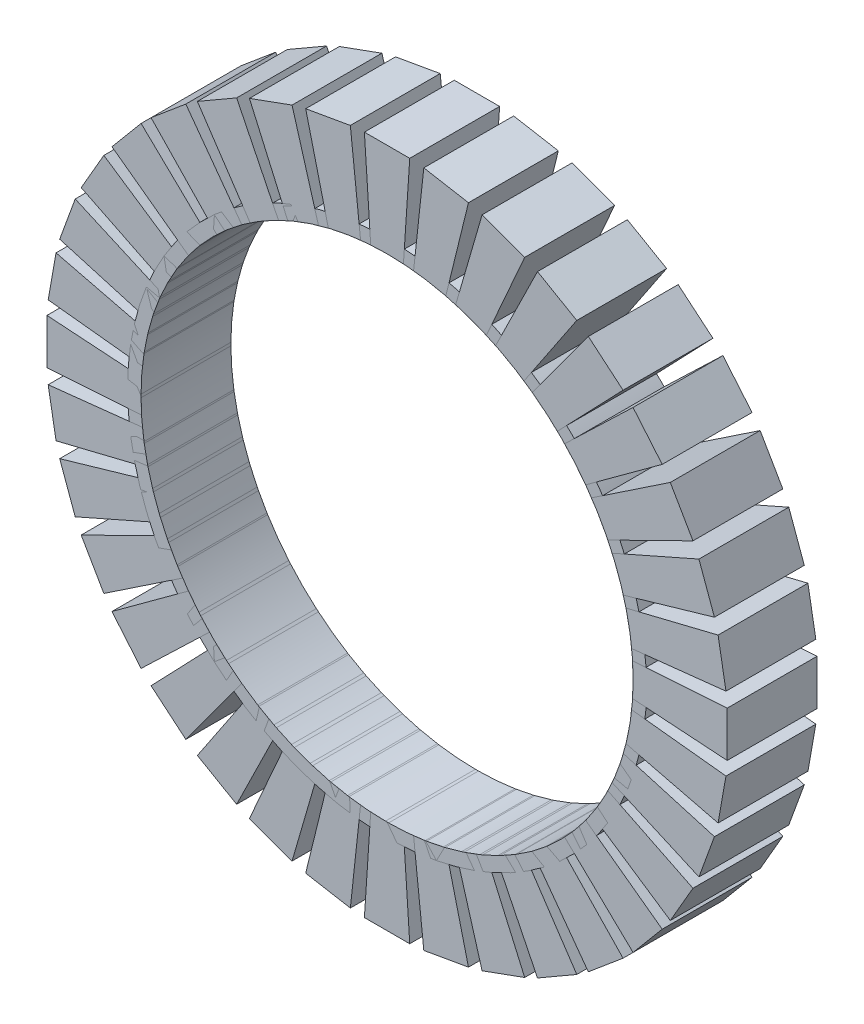
from build123d import *

# Parameters (mm, degrees)
BOSS_EXTRUDE1_DEPTH    = 10.7
BOSS_EXTRUDE1_2_DEPTH  = 10.7
BOSS_EXTRUDE1_3_DEPTH  = 10.7
BOSS_EXTRUDE1_4_DEPTH  = 10.7
BOSS_EXTRUDE1_5_DEPTH  = 10.7
BOSS_EXTRUDE1_6_DEPTH  = 10.7
BOSS_EXTRUDE1_7_DEPTH  = 10.7
BOSS_EXTRUDE1_8_DEPTH  = 10.7
BOSS_EXTRUDE1_9_DEPTH  = 10.7
BOSS_EXTRUDE1_10_DEPTH = 10.7
BOSS_EXTRUDE1_11_DEPTH = 10.7
BOSS_EXTRUDE1_12_DEPTH = 10.7
BOSS_EXTRUDE1_13_DEPTH = 10.7
BOSS_EXTRUDE1_14_DEPTH = 10.7
BOSS_EXTRUDE1_15_DEPTH = 10.7
BOSS_EXTRUDE1_16_DEPTH = 10.7
BOSS_EXTRUDE1_17_DEPTH = 10.7
BOSS_EXTRUDE1_18_DEPTH = 10.7
BOSS_EXTRUDE1_19_DEPTH = 10.7
BOSS_EXTRUDE1_20_DEPTH = 10.7
BOSS_EXTRUDE1_21_DEPTH = 10.7
BOSS_EXTRUDE1_22_DEPTH = 10.7
BOSS_EXTRUDE1_23_DEPTH = 10.7
BOSS_EXTRUDE1_24_DEPTH = 10.7
BOSS_EXTRUDE1_25_DEPTH = 10.7
BOSS_EXTRUDE1_26_DEPTH = 10.7
BOSS_EXTRUDE1_27_DEPTH = 10.7
BOSS_EXTRUDE1_28_DEPTH = 10.7
BOSS_EXTRUDE1_29_DEPTH = 10.7
BOSS_EXTRUDE1_30_DEPTH = 10.7
BOSS_EXTRUDE1_31_DEPTH = 10.7
BOSS_EXTRUDE1_32_DEPTH = 10.7
BOSS_EXTRUDE1_33_DEPTH = 10.7
BOSS_EXTRUDE1_34_DEPTH = 10.7
BOSS_EXTRUDE1_35_DEPTH = 10.7
BOSS_EXTRUDE1_36_DEPTH = 10.7
SKETCH2_R              = 30.9
SKETCH2_R_2            = 29.3
BOSS_EXTRUDE2_DEPTH    = 10.7


with BuildPart() as part:
    # Sketch1 → Boss-Extrude1 (new body)
    with BuildSketch(Plane.XY):
        with BuildLine():
            Line((-2.7, 40.5), (2.7, 40.5))
            Line((2.7, 40.5), (1.949007008, 29.235105125))
            ThreePointArc((1.949007008, 29.235105125), (0, 29.3), (-1.949007008, 29.235105125))
            Line((-1.949007008, 29.235105125), (-2.7, 40.5))
        make_face()
    extrude(amount=BOSS_EXTRUDE1_DEPTH)


with BuildPart() as body_2:
    # Sketch1 → Boss-Extrude1 2 (new body)
    with BuildSketch(Plane.XY):
        with BuildLine():
            Line((3.157225516, 29.129399703), (4.373770262, 40.353564077))
            Line((4.373770262, 40.353564077), (9.691732129, 39.415863917))
            Line((9.691732129, 39.415863917), (6.996019941, 28.452516672))
            ThreePointArc((6.996019941, 28.452516672), (5.087891606, 28.854867163), (3.157225516, 29.129399703))
        make_face()
    extrude(amount=BOSS_EXTRUDE1_2_DEPTH)


with BuildPart() as body_3:
    # Sketch1 → Boss-Extrude1 3 (new body)
    with BuildSketch(Plane.XY):
        with BuildLine():
            Line((8.167527341, 28.13861221), (11.314645729, 38.981005529))
            Line((11.314645729, 38.981005529), (16.388985881, 37.134096755))
            Line((16.388985881, 37.134096755), (11.830462349, 26.805412898))
            ThreePointArc((11.830462349, 26.805412898), (10.021190199, 27.532993789), (8.167527341, 28.13861221))
        make_face()
    extrude(amount=BOSS_EXTRUDE1_3_DEPTH)


with BuildPart() as body_4:
    # Sketch1 → Boss-Extrude1 4 (new body)
    with BuildSketch(Plane.XY):
        with BuildLine():
            Line((12.929662981, 26.292847225), (17.91173141, 36.424028853))
            Line((17.91173141, 36.424028853), (22.58826859, 33.724028853))
            Line((22.58826859, 33.724028853), (16.305442144, 24.343840217))
            ThreePointArc((16.305442144, 24.343840217), (14.65, 25.374544331), (12.929662981, 26.292847225))
        make_face()
    extrude(amount=BOSS_EXTRUDE1_4_DEPTH)


with BuildPart() as body_5:
    # Sketch1 → Boss-Extrude1 5 (new body)
    with BuildSketch(Plane.XY):
        with BuildLine():
            Line((17.298937354, 23.648187381), (23.964578196, 32.760326492))
            Line((23.964578196, 32.760326492), (28.101218189, 29.2892734))
            Line((28.101218189, 29.2892734), (20.284989331, 21.142592269))
            ThreePointArc((20.284989331, 21.142592269), (18.833676964, 22.445102183), (17.298937354, 23.648187381))
        make_face()
    extrude(amount=BOSS_EXTRUDE1_5_DEPTH)


with BuildPart() as body_6:
    # Sketch1 → Boss-Extrude1 6 (new body)
    with BuildSketch(Plane.XY):
        with BuildLine():
            Line((21.142592269, 20.284989331), (29.2892734, 28.101218189))
            Line((29.2892734, 28.101218189), (32.760326492, 23.964578196))
            Line((32.760326492, 23.964578196), (23.648187381, 17.298937354))
            ThreePointArc((23.648187381, 17.298937354), (22.445102183, 18.833676964), (21.142592269, 20.284989331))
        make_face()
    extrude(amount=BOSS_EXTRUDE1_6_DEPTH)


with BuildPart() as body_7:
    # Sketch1 → Boss-Extrude1 7 (new body)
    with BuildSketch(Plane.XY):
        with BuildLine():
            Line((24.343840217, 16.305442144), (33.724028853, 22.58826859))
            Line((33.724028853, 22.58826859), (36.424028853, 17.91173141))
            Line((36.424028853, 17.91173141), (26.292847225, 12.929662981))
            ThreePointArc((26.292847225, 12.929662981), (25.374544331, 14.65), (24.343840217, 16.305442144))
        make_face()
    extrude(amount=BOSS_EXTRUDE1_7_DEPTH)


with BuildPart() as body_8:
    # Sketch1 → Boss-Extrude1 8 (new body)
    with BuildSketch(Plane.XY):
        with BuildLine():
            Line((26.805412898, 11.830462349), (37.134096755, 16.388985881))
            Line((37.134096755, 16.388985881), (38.981005529, 11.314645729))
            Line((38.981005529, 11.314645729), (28.13861221, 8.167527341))
            ThreePointArc((28.13861221, 8.167527341), (27.532993789, 10.021190199), (26.805412898, 11.830462349))
        make_face()
    extrude(amount=BOSS_EXTRUDE1_8_DEPTH)


with BuildPart() as body_9:
    # Sketch1 → Boss-Extrude1 9 (new body)
    with BuildSketch(Plane.XY):
        with BuildLine():
            Line((28.452516672, 6.996019941), (39.415863917, 9.691732129))
            Line((39.415863917, 9.691732129), (40.353564077, 4.373770262))
            Line((40.353564077, 4.373770262), (29.129399703, 3.157225516))
            ThreePointArc((29.129399703, 3.157225516), (28.854867163, 5.087891606), (28.452516672, 6.996019941))
        make_face()
    extrude(amount=BOSS_EXTRUDE1_9_DEPTH)


with BuildPart() as body_10:
    # Sketch1 → Boss-Extrude1 10 (new body)
    with BuildSketch(Plane.XY):
        with BuildLine():
            Line((29.235105125, 1.949007008), (40.5, 2.7))
            Line((40.5, 2.7), (40.5, -2.7))
            Line((40.5, -2.7), (29.235105125, -1.949007008))
            ThreePointArc((29.235105125, -1.949007008), (29.3, 0), (29.235105125, 1.949007008))
        make_face()
    extrude(amount=BOSS_EXTRUDE1_10_DEPTH)


with BuildPart() as body_11:
    # Sketch1 → Boss-Extrude1 11 (new body)
    with BuildSketch(Plane.XY):
        with BuildLine():
            Line((29.129399703, -3.157225516), (40.353564077, -4.373770262))
            Line((40.353564077, -4.373770262), (39.415863917, -9.691732129))
            Line((39.415863917, -9.691732129), (28.452516672, -6.996019941))
            ThreePointArc((28.452516672, -6.996019941), (28.854867163, -5.087891606), (29.129399703, -3.157225516))
        make_face()
    extrude(amount=BOSS_EXTRUDE1_11_DEPTH)


with BuildPart() as body_12:
    # Sketch1 → Boss-Extrude1 12 (new body)
    with BuildSketch(Plane.XY):
        with BuildLine():
            Line((28.13861221, -8.167527341), (38.981005529, -11.314645729))
            Line((38.981005529, -11.314645729), (37.134096755, -16.388985881))
            Line((37.134096755, -16.388985881), (26.805412898, -11.830462349))
            ThreePointArc((26.805412898, -11.830462349), (27.532993789, -10.021190199), (28.13861221, -8.167527341))
        make_face()
    extrude(amount=BOSS_EXTRUDE1_12_DEPTH)


with BuildPart() as body_13:
    # Sketch1 → Boss-Extrude1 13 (new body)
    with BuildSketch(Plane.XY):
        with BuildLine():
            Line((26.292847225, -12.929662981), (36.424028853, -17.91173141))
            Line((36.424028853, -17.91173141), (33.724028853, -22.58826859))
            Line((33.724028853, -22.58826859), (24.343840217, -16.305442144))
            ThreePointArc((24.343840217, -16.305442144), (25.374544331, -14.65), (26.292847225, -12.929662981))
        make_face()
    extrude(amount=BOSS_EXTRUDE1_13_DEPTH)


with BuildPart() as body_14:
    # Sketch1 → Boss-Extrude1 14 (new body)
    with BuildSketch(Plane.XY):
        with BuildLine():
            Line((23.648187381, -17.298937354), (32.760326492, -23.964578196))
            Line((32.760326492, -23.964578196), (29.2892734, -28.101218189))
            Line((29.2892734, -28.101218189), (21.142592269, -20.284989331))
            ThreePointArc((21.142592269, -20.284989331), (22.445102183, -18.833676964), (23.648187381, -17.298937354))
        make_face()
    extrude(amount=BOSS_EXTRUDE1_14_DEPTH)


with BuildPart() as body_15:
    # Sketch1 → Boss-Extrude1 15 (new body)
    with BuildSketch(Plane.XY):
        with BuildLine():
            Line((20.284989331, -21.142592269), (28.101218189, -29.2892734))
            Line((28.101218189, -29.2892734), (23.964578196, -32.760326492))
            Line((23.964578196, -32.760326492), (17.298937354, -23.648187381))
            ThreePointArc((17.298937354, -23.648187381), (18.833676964, -22.445102183), (20.284989331, -21.142592269))
        make_face()
    extrude(amount=BOSS_EXTRUDE1_15_DEPTH)


with BuildPart() as body_16:
    # Sketch1 → Boss-Extrude1 16 (new body)
    with BuildSketch(Plane.XY):
        with BuildLine():
            Line((16.305442144, -24.343840217), (22.58826859, -33.724028853))
            Line((22.58826859, -33.724028853), (17.91173141, -36.424028853))
            Line((17.91173141, -36.424028853), (12.929662981, -26.292847225))
            ThreePointArc((12.929662981, -26.292847225), (14.65, -25.374544331), (16.305442144, -24.343840217))
        make_face()
    extrude(amount=BOSS_EXTRUDE1_16_DEPTH)


with BuildPart() as body_17:
    # Sketch1 → Boss-Extrude1 17 (new body)
    with BuildSketch(Plane.XY):
        with BuildLine():
            Line((11.830462349, -26.805412898), (16.388985881, -37.134096755))
            Line((16.388985881, -37.134096755), (11.314645729, -38.981005529))
            Line((11.314645729, -38.981005529), (8.167527341, -28.13861221))
            ThreePointArc((8.167527341, -28.13861221), (10.021190199, -27.532993789), (11.830462349, -26.805412898))
        make_face()
    extrude(amount=BOSS_EXTRUDE1_17_DEPTH)


with BuildPart() as body_18:
    # Sketch1 → Boss-Extrude1 18 (new body)
    with BuildSketch(Plane.XY):
        with BuildLine():
            Line((6.996019941, -28.452516672), (9.691732129, -39.415863917))
            Line((9.691732129, -39.415863917), (4.373770262, -40.353564077))
            Line((4.373770262, -40.353564077), (3.157225516, -29.129399703))
            ThreePointArc((3.157225516, -29.129399703), (5.087891606, -28.854867163), (6.996019941, -28.452516672))
        make_face()
    extrude(amount=BOSS_EXTRUDE1_18_DEPTH)


with BuildPart() as body_19:
    # Sketch1 → Boss-Extrude1 19 (new body)
    with BuildSketch(Plane.XY):
        with BuildLine():
            Line((1.949007008, -29.235105125), (2.7, -40.5))
            Line((2.7, -40.5), (-2.7, -40.5))
            Line((-2.7, -40.5), (-1.949007008, -29.235105125))
            ThreePointArc((-1.949007008, -29.235105125), (0, -29.3), (1.949007008, -29.235105125))
        make_face()
    extrude(amount=BOSS_EXTRUDE1_19_DEPTH)


with BuildPart() as body_20:
    # Sketch1 → Boss-Extrude1 20 (new body)
    with BuildSketch(Plane.XY):
        with BuildLine():
            Line((-3.157225516, -29.129399703), (-4.373770262, -40.353564077))
            Line((-4.373770262, -40.353564077), (-9.691732129, -39.415863917))
            Line((-9.691732129, -39.415863917), (-6.996019941, -28.452516672))
            ThreePointArc((-6.996019941, -28.452516672), (-5.087891606, -28.854867163), (-3.157225516, -29.129399703))
        make_face()
    extrude(amount=BOSS_EXTRUDE1_20_DEPTH)


with BuildPart() as body_21:
    # Sketch1 → Boss-Extrude1 21 (new body)
    with BuildSketch(Plane.XY):
        with BuildLine():
            Line((-8.167527341, -28.13861221), (-11.314645729, -38.981005529))
            Line((-11.314645729, -38.981005529), (-16.388985881, -37.134096755))
            Line((-16.388985881, -37.134096755), (-11.830462349, -26.805412898))
            ThreePointArc((-11.830462349, -26.805412898), (-10.021190199, -27.532993789), (-8.167527341, -28.13861221))
        make_face()
    extrude(amount=BOSS_EXTRUDE1_21_DEPTH)


with BuildPart() as body_22:
    # Sketch1 → Boss-Extrude1 22 (new body)
    with BuildSketch(Plane.XY):
        with BuildLine():
            Line((-12.929662981, -26.292847225), (-17.91173141, -36.424028853))
            Line((-17.91173141, -36.424028853), (-22.58826859, -33.724028853))
            Line((-22.58826859, -33.724028853), (-16.305442144, -24.343840217))
            ThreePointArc((-16.305442144, -24.343840217), (-14.65, -25.374544331), (-12.929662981, -26.292847225))
        make_face()
    extrude(amount=BOSS_EXTRUDE1_22_DEPTH)


with BuildPart() as body_23:
    # Sketch1 → Boss-Extrude1 23 (new body)
    with BuildSketch(Plane.XY):
        with BuildLine():
            Line((-17.298937354, -23.648187381), (-23.964578196, -32.760326492))
            Line((-23.964578196, -32.760326492), (-28.101218189, -29.2892734))
            Line((-28.101218189, -29.2892734), (-20.284989331, -21.142592269))
            ThreePointArc((-20.284989331, -21.142592269), (-18.833676964, -22.445102183), (-17.298937354, -23.648187381))
        make_face()
    extrude(amount=BOSS_EXTRUDE1_23_DEPTH)


with BuildPart() as body_24:
    # Sketch1 → Boss-Extrude1 24 (new body)
    with BuildSketch(Plane.XY):
        with BuildLine():
            Line((-21.142592269, -20.284989331), (-29.2892734, -28.101218189))
            Line((-29.2892734, -28.101218189), (-32.760326492, -23.964578196))
            Line((-32.760326492, -23.964578196), (-23.648187381, -17.298937354))
            ThreePointArc((-23.648187381, -17.298937354), (-22.445102183, -18.833676964), (-21.142592269, -20.284989331))
        make_face()
    extrude(amount=BOSS_EXTRUDE1_24_DEPTH)


with BuildPart() as body_25:
    # Sketch1 → Boss-Extrude1 25 (new body)
    with BuildSketch(Plane.XY):
        with BuildLine():
            Line((-24.343840217, -16.305442144), (-33.724028853, -22.58826859))
            Line((-33.724028853, -22.58826859), (-36.424028853, -17.91173141))
            Line((-36.424028853, -17.91173141), (-26.292847225, -12.929662981))
            ThreePointArc((-26.292847225, -12.929662981), (-25.374544331, -14.65), (-24.343840217, -16.305442144))
        make_face()
    extrude(amount=BOSS_EXTRUDE1_25_DEPTH)


with BuildPart() as body_26:
    # Sketch1 → Boss-Extrude1 26 (new body)
    with BuildSketch(Plane.XY):
        with BuildLine():
            Line((-26.805412898, -11.830462349), (-37.134096755, -16.388985881))
            Line((-37.134096755, -16.388985881), (-38.981005529, -11.314645729))
            Line((-38.981005529, -11.314645729), (-28.13861221, -8.167527341))
            ThreePointArc((-28.13861221, -8.167527341), (-27.532993789, -10.021190199), (-26.805412898, -11.830462349))
        make_face()
    extrude(amount=BOSS_EXTRUDE1_26_DEPTH)


with BuildPart() as body_27:
    # Sketch1 → Boss-Extrude1 27 (new body)
    with BuildSketch(Plane.XY):
        with BuildLine():
            Line((-28.452516672, -6.996019941), (-39.415863917, -9.691732129))
            Line((-39.415863917, -9.691732129), (-40.353564077, -4.373770262))
            Line((-40.353564077, -4.373770262), (-29.129399703, -3.157225516))
            ThreePointArc((-29.129399703, -3.157225516), (-28.854867163, -5.087891606), (-28.452516672, -6.996019941))
        make_face()
    extrude(amount=BOSS_EXTRUDE1_27_DEPTH)


with BuildPart() as body_28:
    # Sketch1 → Boss-Extrude1 28 (new body)
    with BuildSketch(Plane.XY):
        with BuildLine():
            Line((-29.235105125, -1.949007008), (-40.5, -2.7))
            Line((-40.5, -2.7), (-40.5, 2.7))
            Line((-40.5, 2.7), (-29.235105125, 1.949007008))
            ThreePointArc((-29.235105125, 1.949007008), (-29.3, 0), (-29.235105125, -1.949007008))
        make_face()
    extrude(amount=BOSS_EXTRUDE1_28_DEPTH)


with BuildPart() as body_29:
    # Sketch1 → Boss-Extrude1 29 (new body)
    with BuildSketch(Plane.XY):
        with BuildLine():
            Line((-29.129399703, 3.157225516), (-40.353564077, 4.373770262))
            Line((-40.353564077, 4.373770262), (-39.415863917, 9.691732129))
            Line((-39.415863917, 9.691732129), (-28.452516672, 6.996019941))
            ThreePointArc((-28.452516672, 6.996019941), (-28.854867163, 5.087891606), (-29.129399703, 3.157225516))
        make_face()
    extrude(amount=BOSS_EXTRUDE1_29_DEPTH)


with BuildPart() as body_30:
    # Sketch1 → Boss-Extrude1 30 (new body)
    with BuildSketch(Plane.XY):
        with BuildLine():
            Line((-28.13861221, 8.167527341), (-38.981005529, 11.314645729))
            Line((-38.981005529, 11.314645729), (-37.134096755, 16.388985881))
            Line((-37.134096755, 16.388985881), (-26.805412898, 11.830462349))
            ThreePointArc((-26.805412898, 11.830462349), (-27.532993789, 10.021190199), (-28.13861221, 8.167527341))
        make_face()
    extrude(amount=BOSS_EXTRUDE1_30_DEPTH)


with BuildPart() as body_31:
    # Sketch1 → Boss-Extrude1 31 (new body)
    with BuildSketch(Plane.XY):
        with BuildLine():
            Line((-26.292847225, 12.929662981), (-36.424028853, 17.91173141))
            Line((-36.424028853, 17.91173141), (-33.724028853, 22.58826859))
            Line((-33.724028853, 22.58826859), (-24.343840217, 16.305442144))
            ThreePointArc((-24.343840217, 16.305442144), (-25.374544331, 14.65), (-26.292847225, 12.929662981))
        make_face()
    extrude(amount=BOSS_EXTRUDE1_31_DEPTH)


with BuildPart() as body_32:
    # Sketch1 → Boss-Extrude1 32 (new body)
    with BuildSketch(Plane.XY):
        with BuildLine():
            Line((-23.648187381, 17.298937354), (-32.760326492, 23.964578196))
            Line((-32.760326492, 23.964578196), (-29.2892734, 28.101218189))
            Line((-29.2892734, 28.101218189), (-21.142592269, 20.284989331))
            ThreePointArc((-21.142592269, 20.284989331), (-22.445102183, 18.833676964), (-23.648187381, 17.298937354))
        make_face()
    extrude(amount=BOSS_EXTRUDE1_32_DEPTH)


with BuildPart() as body_33:
    # Sketch1 → Boss-Extrude1 33 (new body)
    with BuildSketch(Plane.XY):
        with BuildLine():
            Line((-20.284989331, 21.142592269), (-28.101218189, 29.2892734))
            Line((-28.101218189, 29.2892734), (-23.964578196, 32.760326492))
            Line((-23.964578196, 32.760326492), (-17.298937354, 23.648187381))
            ThreePointArc((-17.298937354, 23.648187381), (-18.833676964, 22.445102183), (-20.284989331, 21.142592269))
        make_face()
    extrude(amount=BOSS_EXTRUDE1_33_DEPTH)


with BuildPart() as body_34:
    # Sketch1 → Boss-Extrude1 34 (new body)
    with BuildSketch(Plane.XY):
        with BuildLine():
            Line((-16.305442144, 24.343840217), (-22.58826859, 33.724028853))
            Line((-22.58826859, 33.724028853), (-17.91173141, 36.424028853))
            Line((-17.91173141, 36.424028853), (-12.929662981, 26.292847225))
            ThreePointArc((-12.929662981, 26.292847225), (-14.65, 25.374544331), (-16.305442144, 24.343840217))
        make_face()
    extrude(amount=BOSS_EXTRUDE1_34_DEPTH)


with BuildPart() as body_35:
    # Sketch1 → Boss-Extrude1 35 (new body)
    with BuildSketch(Plane.XY):
        with BuildLine():
            Line((-11.830462349, 26.805412898), (-16.388985881, 37.134096755))
            Line((-16.388985881, 37.134096755), (-11.314645729, 38.981005529))
            Line((-11.314645729, 38.981005529), (-8.167527341, 28.13861221))
            ThreePointArc((-8.167527341, 28.13861221), (-10.021190199, 27.532993789), (-11.830462349, 26.805412898))
        make_face()
    extrude(amount=BOSS_EXTRUDE1_35_DEPTH)


with BuildPart() as body_36:
    # Sketch1 → Boss-Extrude1 36 (new body)
    with BuildSketch(Plane.XY):
        with BuildLine():
            Line((-6.996019941, 28.452516672), (-9.691732129, 39.415863917))
            Line((-9.691732129, 39.415863917), (-4.373770262, 40.353564077))
            Line((-4.373770262, 40.353564077), (-3.157225516, 29.129399703))
            ThreePointArc((-3.157225516, 29.129399703), (-5.087891606, 28.854867163), (-6.996019941, 28.452516672))
        make_face()
    extrude(amount=BOSS_EXTRUDE1_36_DEPTH)


with BuildPart() as body_37:
    # Sketch2 → Boss-Extrude2 (new body)
    with BuildSketch(Plane.XY):
        Circle(SKETCH2_R)
        Circle(SKETCH2_R_2, mode=Mode.SUBTRACT)
    extrude(amount=BOSS_EXTRUDE2_DEPTH)


solid = Compound([part.part, body_2.part, body_3.part, body_4.part, body_5.part, body_6.part, body_7.part, body_8.part, body_9.part, body_10.part, body_11.part, body_12.part, body_13.part, body_14.part, body_15.part, body_16.part, body_17.part, body_18.part, body_19.part, body_20.part, body_21.part, body_22.part, body_23.part, body_24.part, body_25.part, body_26.part, body_27.part, body_28.part, body_29.part, body_30.part, body_31.part, body_32.part, body_33.part, body_34.part, body_35.part, body_36.part, body_37.part])
